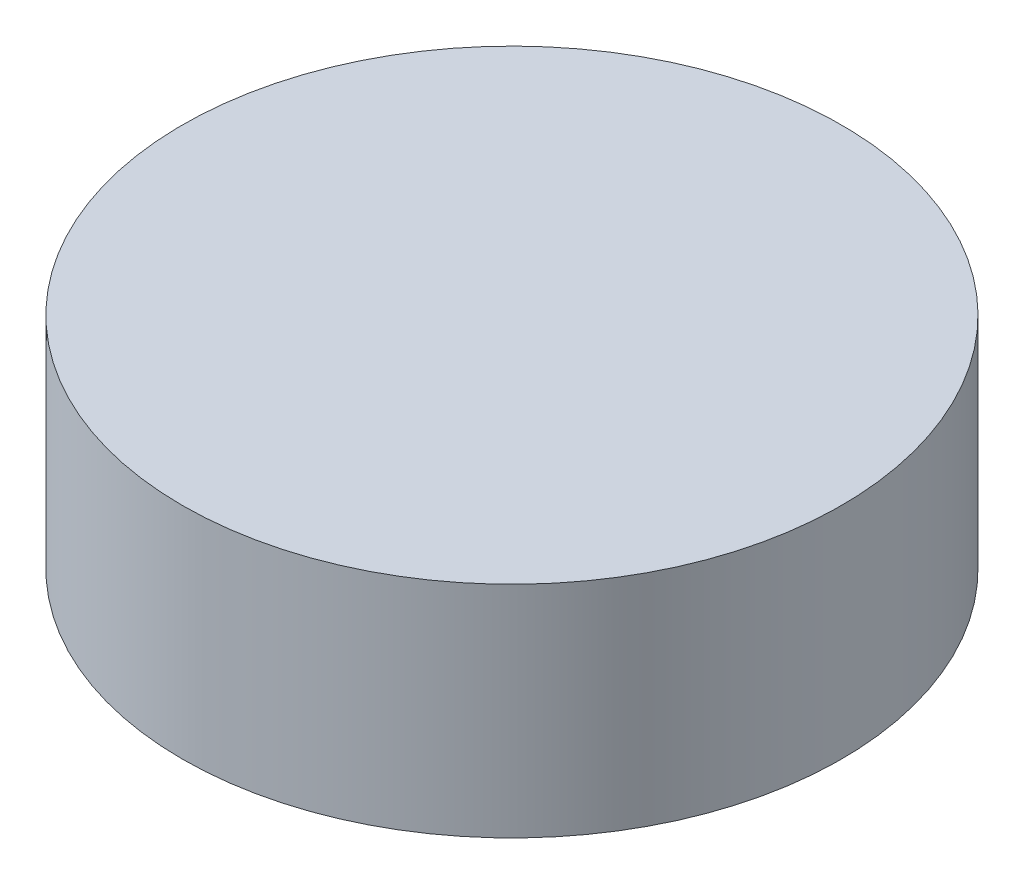
from build123d import *

# Parameters (mm, degrees)
IZIM1_R                     = 30
Y_KSEKLIK_EKSTR_ZYON1_DEPTH = 20


with BuildPart() as part:
    # Çizim1 → Yükseklik-Ekstrüzyon1 (new body)
    with BuildSketch(Plane(origin=(0, 0, 0), x_dir=(1, 0, 0), z_dir=(0, 1, 0))):
        with Locations(Location((0, 0, 0), (0, 0, 270))):
            Circle(IZIM1_R)
    extrude(amount=Y_KSEKLIK_EKSTR_ZYON1_DEPTH)


solid = part.part
